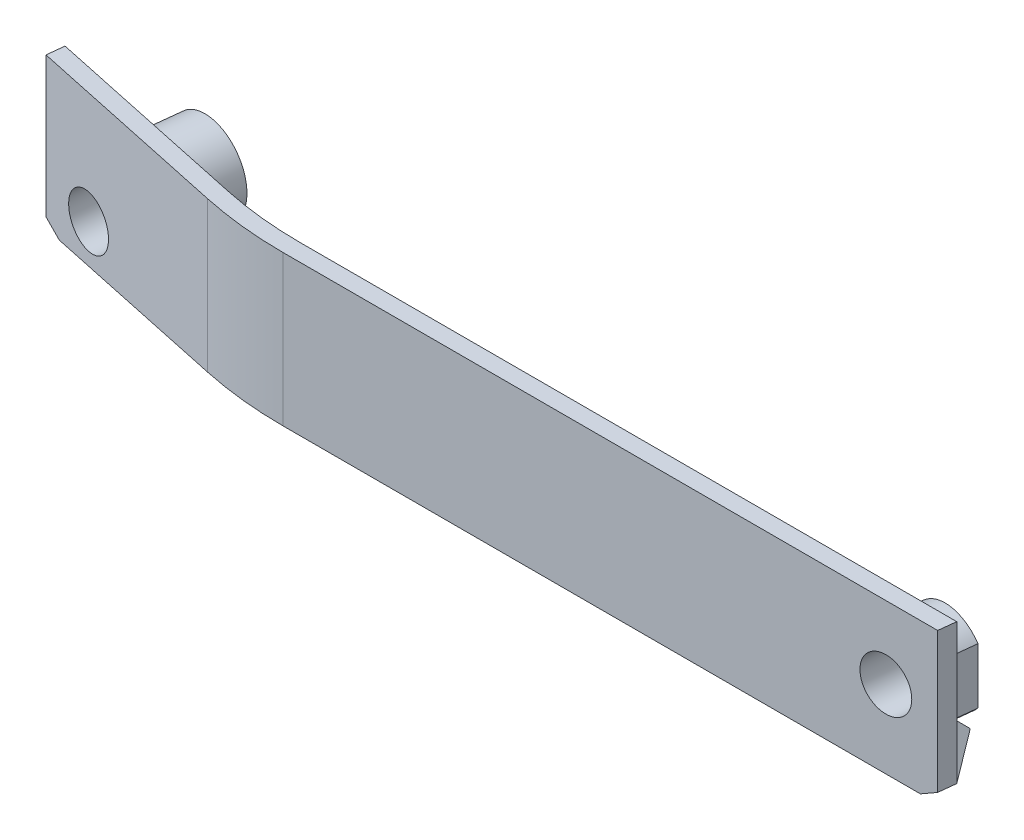
from build123d import *

# Parameters (mm, degrees)
SKETCH1_W           = 76.498745459
SKETCH1_H           = 16.339745962
EXTRUDE1_DEPTH      = 2
SKETCH2_W           = 24.663668615
SKETCH2_H           = 16.339745962
EXTRUDE2_DEPTH      = 2
EXTRUDE3_DEPTH      = 16.339746
EXTRUDE4_DEPTH      = 2
EXTRUDE5_DEPTH      = 2
SKETCH6_W           = 24.021275531
SKETCH6_H           = 33.549299437
CUT_EXTRUDE2_DEPTH  = 5
SKETCH7_W           = 19.882310522
SKETCH7_H           = 22.758948474
CUT_EXTRUDE3_DEPTH  = 5
SKETCH8_W           = 89.248411888
SKETCH8_H           = 36.273905792
CUT_EXTRUDE4_DEPTH  = 5
SKETCH9_W           = 105.763953189
SKETCH9_H           = 17.720813838
CUT_EXTRUDE5_DEPTH  = 5
SKETCH10_W          = 34.758116025
SKETCH10_H          = 9.090411144
CUT_EXTRUDE6_DEPTH  = 5
SKETCH11_W          = 43.05920404
SKETCH11_H          = 32.49855368
CUT_EXTRUDE7_DEPTH  = 5
SKETCH12_W          = 30.563373624
SKETCH12_H          = 19.163652291
CUT_EXTRUDE8_DEPTH  = 5
CUT_EXTRUDE9_DEPTH  = 5
EXTRUDE6_REACH      = 127.538
SKETCH17_R          = 1.6
SKETCH18_R          = 3
CUT_EXTRUDE10_DEPTH = 46


with BuildPart() as part:
    # Sketch1 → Extrude1 (new body)
    with BuildSketch(Plane.XY):
        with Locations((24.172246601, 100.676372122)):
            Rectangle(SKETCH1_W, SKETCH1_H)
    extrude(amount=EXTRUDE1_DEPTH)



with BuildPart() as body_2:
    # Sketch2 → Extrude2 (new body)
    with BuildSketch(Plane(origin=(-0.816696373, 0, 3.834120606), x_dir=(0.9780578191404126, 0, 0.2083336324703724), z_dir=(-0.2083336324703724, -4.010680676458379e-15, 0.9780578191404126))):
        with Locations((-35.47509105, 100.676372122)):
            Rectangle(SKETCH2_W, SKETCH2_H)
    extrude(amount=EXTRUDE2_DEPTH)


with BuildPart() as part_1:
    add(part.part)

    add(body_2.part)  # Extrude3 merges body 2
    # Sketch3 → Extrude3 (add)
    with BuildSketch(Plane.XZ.offset(-92.506499141)):
        with BuildLine():
            Line((-14.077126129, 2), (-14.077126129, 0))
            ThreePointArc((-14.077126129, 0), (-18.790559922, -0.247530326), (-23.45213959, -0.987398139))
            Line((-23.45213959, -0.987398139), (-23.868806855, 0.9687175))
            ThreePointArc((-23.868806855, 0.9687175), (-19.000045868, 1.741468326), (-14.077126129, 2))
        make_face()
    extrude(amount=-EXTRUDE3_DEPTH)

    # Sketch4 → Extrude4 (add)
    with BuildSketch(Plane(origin=(0, 69.379874356, -40.056489136), x_dir=(1, 0, 0), z_dir=(1.6628191878975688e-14, -0.8660254037844406, 0.49999999999999695))):
        Polygon((48.995874099, 28.932741495), (66.339290827, 48.549555392), (-14.077126129, 48.549555392), (-14.077126129, 28.932741495), align=None)
    extrude(amount=EXTRUDE4_DEPTH)

    # Sketch5 → Extrude5 (add)
    with BuildSketch(Plane(origin=(8.140939792, 67.682405259, -38.219032255), x_dir=(0.9945598395247158, -0.09070455643384139, 0.0512192253622747), z_dir=(-0.1041668162351687, -0.866025403784443, 0.4890289095702023))):
        Polygon((-39.522656048, 25.582379856), (-28.623792922, 27.592891937), (-32.348610718, 47.784901585), (-60.160615909, 42.251632984), align=None)
    extrude(amount=EXTRUDE5_DEPTH)

    # Sketch6 → Cut-Extrude2 (cut)
    with BuildSketch(Plane(origin=(-24.396405636, 42.515816182, -2.71052281), x_dir=(0.867783590939769, 0.49593545163938957, -0.031617512598470475), z_dir=(0.4969422897034219, -0.8660254037844308, 0.05521196160555937))):
        with Locations((92.951842282, -1.018457271)):
            Rectangle(SKETCH6_W, SKETCH6_H)
    extrude(amount=CUT_EXTRUDE2_DEPTH, mode=Mode.SUBTRACT)

    # Sketch7 → Cut-Extrude3 (cut)
    with BuildSketch(Plane(origin=(61.660484884, 0, 6.850687483), x_dir=(0.11042392321111931, 2.1241172155137457e-15, -0.9938845794068167), z_dir=(0.9938845794068167, 1.91183874287404e-14, 0.11042392321111931))):
        with Locations((3.336054833, 99.931868434)):
            Rectangle(SKETCH7_W, SKETCH7_H)
    extrude(amount=CUT_EXTRUDE3_DEPTH, mode=Mode.SUBTRACT)

    # Sketch8 → Cut-Extrude4 (cut)
    with BuildSketch(Plane.XZ.offset(-83.846245103)):
        with Locations((7.257561645, -23.336285345)):
            Rectangle(SKETCH8_W, SKETCH8_H)
    extrude(amount=CUT_EXTRUDE4_DEPTH, mode=Mode.SUBTRACT)

    # Sketch9 → Cut-Extrude5 (cut)
    with BuildSketch(Plane.XY.offset(2)):
        with Locations((13.489075652, 93.672145699)):
            Rectangle(SKETCH9_W, SKETCH9_H)
    extrude(amount=CUT_EXTRUDE5_DEPTH, mode=Mode.SUBTRACT)

    # Sketch10 → Cut-Extrude6 (cut)
    with BuildSketch(Plane(origin=(-1.233363638, 0, 5.790236244), x_dir=(0.9780578191404125, 0, 0.2083336324703724), z_dir=(-0.20833363247037243, -4.0496183161323325e-15, 0.9780578191404126))):
        with Locations((-35.327877251, 93.473511189)):
            Rectangle(SKETCH10_W, SKETCH10_H)
    extrude(amount=CUT_EXTRUDE6_DEPTH, mode=Mode.SUBTRACT)

    # Sketch11 → Cut-Extrude7 (cut)
    with BuildSketch(Plane(origin=(-47.66681885, 0, -5.29594407), x_dir=(-0.11042392321111921, -2.1239244818946968e-15, 0.9938845794068167), z_dir=(-0.9938845794068167, -1.9116652705264417e-14, -0.11042392321111921))):
        with Locations((-0.835470819, 96.627603238)):
            Rectangle(SKETCH11_W, SKETCH11_H)
    extrude(amount=CUT_EXTRUDE7_DEPTH, mode=Mode.SUBTRACT)

    # Sketch12 → Cut-Extrude8 (cut)
    with BuildSketch(Plane(origin=(27.894822145, 48.612535322, 3.099208663), x_dir=(0.8677835909397874, -0.4959354516393574, -0.03161751259846775), z_dir=(-0.4969422897033898, -0.8660254037844495, -0.05521196160555938))):
        with Locations((-76.494352482, -16.060277262)):
            Rectangle(SKETCH12_W, SKETCH12_H)
    extrude(amount=CUT_EXTRUDE8_DEPTH, mode=Mode.SUBTRACT)

    # Sweep1: sweep along a curve in space
    with BuildLine() as sweep1_path:
        ThreePointArc((-23.45213959, 92.506499141, -0.987398139), (-18.790559922, 92.506499141, -0.247530326), (-14.077126129, 92.506499141, 0))
    # Sketch15 → Sweep1 (sweep)
    with BuildSketch(Plane(origin=(-22.635443217, 0, -4.821518744), x_dir=(0.2083336324703729, 4.064599859131597e-15, -0.9780578191404125), z_dir=(0.9780578191404125, 1.908195823574488e-14, 0.2083336324703729))):
        Polygon((-5.92013696, 92.506499141), (-5.92013696, 91.351798603), (7.07986304, 83.846245103), (11.07986304, 83.846245103), (-3.92013696, 92.506499141), align=None)
    sweep(path=sweep1_path.line)

    # Sketch16 → Cut-Extrude9 (cut)
    with BuildSketch(Plane(origin=(0, 67.647823548, -39.056489136), x_dir=(1, 0, 0), z_dir=(1.6740836018830237e-14, -0.8660254037844403, 0.4999999999999971))):
        with BuildLine():
            Line((-14.077126129, 24.677772288), (-14.077126129, 40.969683028))
            ThreePointArc((-14.077126129, 40.969683028), (-8.077126129, 46.969683028), (-2.077126129, 40.969683028))
            Line((-2.077126129, 40.969683028), (-2.077126129, 24.677772288))
            ThreePointArc((-2.077126129, 24.677772288), (-8.077126129, 18.677772288), (-14.077126129, 24.677772288))
        make_face()
    extrude(amount=-CUT_EXTRUDE9_DEPTH, mode=Mode.SUBTRACT)

    # Sketch17 → Extrude6 (add, up to next)
    with BuildSketch(Plane(origin=(1.202830139, 0, -10.826225801), x_dir=(0.9938845794068167, 0, 0.11042392321111931), z_dir=(-0.11042392321111931, -2.5465740627339532e-15, 0.9938845794068167)), mode=Mode.PRIVATE) as extrude6_sk1:
        with BuildLine():
            Line((-45.760115126, 98.553158182), (-45.760115126, 93.776669733))
            Line((-45.760115126, 93.776669733), (-40.803979116, 90.915243274))
            ThreePointArc((-40.803979116, 90.915243274), (-37.353292881, 98.581286318), (-45.760115126, 98.553158182))
        make_face()
        with Locations(Location((-41.547644752, 95.859630134, 0), (0, 0, 180))):
            Circle(SKETCH17_R, mode=Mode.SUBTRACT)
    extrude6_tool1 = extrude(extrude6_sk1.sketch, amount=EXTRUDE6_REACH, mode=Mode.PRIVATE) - part_1.part
    # Sketch17 → Extrude6 (add, up to next)
    with BuildSketch(Plane(origin=(1.202830139, 0, -10.826225801), x_dir=(0.9938845794068167, 0, 0.11042392321111931), z_dir=(-0.11042392321111931, -2.5465740627339532e-15, 0.9938845794068167)), mode=Mode.PRIVATE) as extrude6_sk2:
        with BuildLine():
            Line((59.839884874, 103.643328995), (59.839884874, 97.144098271))
            ThreePointArc((59.839884874, 97.144098271), (51.039884874, 100.393713633), (59.839884874, 103.643328995))
        make_face()
        with Locations((56.039884874, 100.393713633)):
            Circle(SKETCH17_R, mode=Mode.SUBTRACT)
    extrude6_tool2 = extrude(extrude6_sk2.sketch, amount=EXTRUDE6_REACH, mode=Mode.PRIVATE) - part_1.part
    add(extrude6_tool1.solids().sort_by_distance((-36.035052, 98.507498, -14.96348))[0])
    add(extrude6_tool2.solids().sort_by_distance((60.544377, 100.393714, -4.23318))[0])

    # Sketch18 → Cut-Extrude10 (cut)
    with BuildSketch(Plane(origin=(0.981982292, 0, -8.838456642), x_dir=(0.9938845794068167, 0, 0.11042392321111931), z_dir=(-0.11042392321111931, -2.5465740627339532e-15, 0.9938845794068167))):
        with Locations(Location((-41.547644752, 95.859630134, 0), (0, 0, 180))):
            Circle(SKETCH18_R)
        with Locations((56.039884874, 100.393713633)):
            Circle(SKETCH18_R)
    extrude(amount=CUT_EXTRUDE10_DEPTH, mode=Mode.SUBTRACT)


solid = part_1.part
